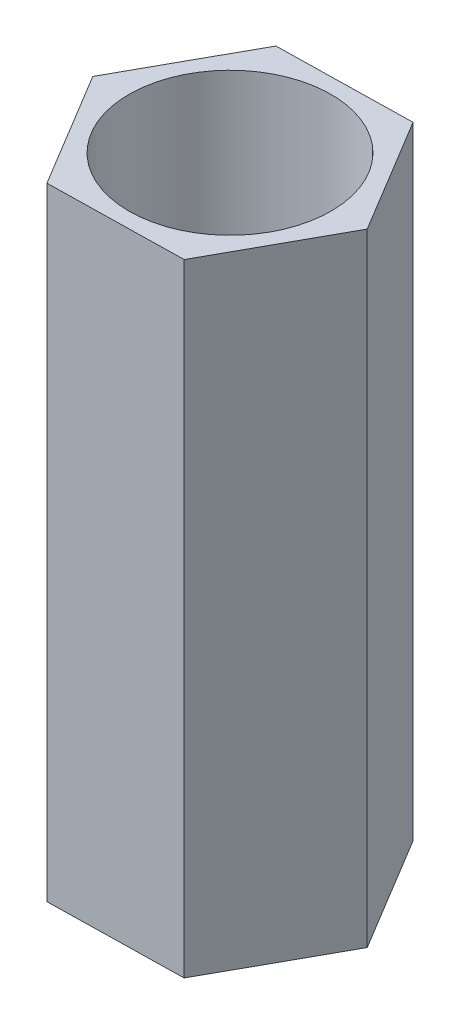
from build123d import *

# Parameters (mm, degrees)
SKETCH1_R           = 1.3
BOSS_EXTRUDE1_DEPTH = 8


with BuildPart() as part:
    # Sketch1 → Boss-Extrude1 (new body)
    with BuildSketch(Plane(origin=(0, 0, 0), x_dir=(1, 0, 0), z_dir=(0, 1, 0))):
        Polygon((0.89406213, -1.483459776), (1.731744917, 0.032550629), (0.837682787, 1.516010405), (-0.89406213, 1.483459776), (-1.731744917, -0.032550629), (-0.837682787, -1.516010405), align=None)
        with Locations(Location((0, 0, 0), (0, 0, 270))):
            Circle(SKETCH1_R, mode=Mode.SUBTRACT)
    extrude(amount=BOSS_EXTRUDE1_DEPTH)


solid = part.part
